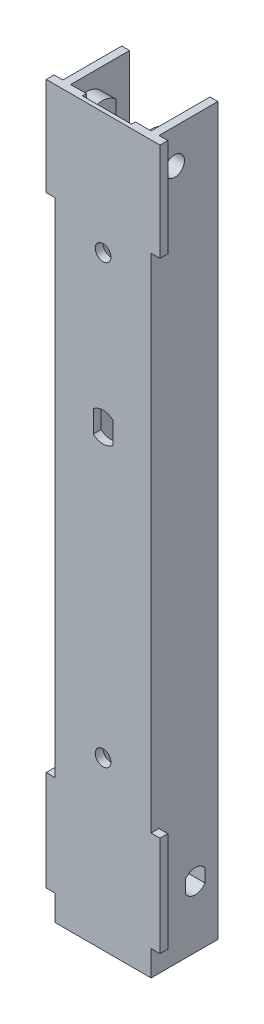
from build123d import *

# Parameters (mm, degrees)
BOSS_EXTRUDE1_DEPTH     = 370
SKETCH9_W               = 58
SKETCH9_H               = 50
SKETCH9_H_2             = 51
BOSS_EXTRUDE2_DEPTH     = 4
SKETCH14_R              = 5
BOSS_EXTRUDE3_DEPTH     = 49
CUT_EXTRUDE4_REACH      = 377.391
SKETCH15_W              = 25
SKETCH15_H              = 30
SKETCH15_W_2            = 30
SKETCH15_H_2            = 67.188472817
SKETCH16_R              = 4
CUT_EXTRUDE5_DEPTH      = 376.049663378
CUT_EXTRUDE6_DEPTH      = 376.049663378
CUT_EXTRUDE7_DEPTH      = 375.841633227
CUT_EXTRUDE7_DEPTH_BACK = 375.841633227
SKETCH18_R              = 5
CUT_EXTRUDE8_DEPTH      = 12.5


with BuildPart() as part:
    # Sketch3 → Boss-Extrude1 (new body)
    with BuildSketch(Plane(origin=(0, 0, 0), x_dir=(1, 0, 0), z_dir=(0, 1, 0))):
        Polygon((0, 0), (-49, 0), (-49, 34), (-45, 34), (-45, 4), (-4, 4), (-4, 34), (0, 34), align=None)
    extrude(amount=BOSS_EXTRUDE1_DEPTH)

    # Sketch9 → Boss-Extrude2 (add)
    with BuildSketch(Plane.XY):
        with Locations((-24.5, 345)):
            Rectangle(SKETCH9_W, SKETCH9_H)
        with Locations((-24.5, 38.5)):
            Rectangle(SKETCH9_W, SKETCH9_H_2)
    extrude(amount=-BOSS_EXTRUDE2_DEPTH)

    # Sketch14 → Boss-Extrude3 (add)
    # profile 1 of 2: a face of its own
    with BuildSketch(Plane(origin=(0, 0, 0), x_dir=(0, 0, -1), z_dir=(1, 0, 0))):
        with BuildLine():
            Line((19, 360.05579248), (19, 344.94420752))
            ThreePointArc((19, 344.94420752), (12, 342.2), (5, 344.94420752))
            Line((5, 344.94420752), (5, 360.05579248))
            ThreePointArc((5, 360.05579248), (12, 362.8), (19, 360.05579248))
        make_face()
        with Locations((12, 352.5)):
            Circle(SKETCH14_R, mode=Mode.SUBTRACT)
    # profile 2 of 2: a face of its own
    with BuildSketch(Plane(origin=(0, 0, 0), x_dir=(0, 0, -1), z_dir=(1, 0, 0))):
        with BuildLine():
            Line((29.5, 38.5), (29.5, 27.627016654))
            ThreePointArc((29.5, 27.627016654), (15.608560863, 27.436987987), (22.5, 39.5))
            Line((22.5, 39.5), (28.5, 39.5))
            Line((28.5, 39.5), (29.5, 38.5))
        make_face()
        with BuildLine():
            Line((27.5, 34.81662479), (27.5, 28.18337521))
            ThreePointArc((27.5, 28.18337521), (22.5, 25.5), (17.5, 28.18337521))
            Line((17.5, 28.18337521), (17.5, 34.81662479))
            ThreePointArc((17.5, 34.81662479), (22.5, 37.5), (27.5, 34.81662479))
        make_face(mode=Mode.SUBTRACT)
    extrude(amount=-BOSS_EXTRUDE3_DEPTH)

    # Cut-Extrude4: up to this face of the body (flat: up to its plane)
    cut_extrude4_end = Plane(part.part.faces().sort_by_distance((-24.5, 185, -4))[0])
    # Sketch15 → Cut-Extrude4 (cut, up to the picked face)
    with BuildSketch(Plane(origin=(0, 0, -34), x_dir=(-1, 0, 0), z_dir=(0, 0, -1)), mode=Mode.PRIVATE) as cut_extrude4_sk1:
        with Locations((24.5, 355)):
            Rectangle(SKETCH15_W, SKETCH15_H)
    cut_extrude4_tool1 = split(extrude(cut_extrude4_sk1.sketch, amount=-CUT_EXTRUDE4_REACH, mode=Mode.PRIVATE), bisect_by=cut_extrude4_end, keep=Keep.BOTH, mode=Mode.PRIVATE)
    # Sketch15 → Cut-Extrude4 (cut, up to the picked face)
    with BuildSketch(Plane(origin=(0, 0, -34), x_dir=(-1, 0, 0), z_dir=(0, 0, -1)), mode=Mode.PRIVATE) as cut_extrude4_sk2:
        with Locations((24.5, 33.594236409)):
            Rectangle(SKETCH15_W_2, SKETCH15_H_2)
    cut_extrude4_tool2 = split(extrude(cut_extrude4_sk2.sketch, amount=-CUT_EXTRUDE4_REACH, mode=Mode.PRIVATE), bisect_by=cut_extrude4_end, keep=Keep.BOTH, mode=Mode.PRIVATE)
    add(cut_extrude4_tool1.solids().sort_by(Axis((-24.5, 355, -34), (0, 0, 1)))[0], mode=Mode.SUBTRACT)
    add(cut_extrude4_tool2.solids().sort_by(Axis((-24.5, 33.594236, -34), (0, 0, 1)))[0], mode=Mode.SUBTRACT)

    # Sketch16 → Cut-Extrude5 (cut, through all)
    with BuildSketch(Plane(origin=(0, 0, -4), x_dir=(-1, 0, 0), z_dir=(0, 0, -1))):
        with Locations((24.5, 85)):
            Circle(SKETCH16_R)
        with Locations((24.5, 308)):
            Circle(SKETCH16_R)
    extrude(amount=-CUT_EXTRUDE5_DEPTH, mode=Mode.SUBTRACT)

    # Sketch17 → Cut-Extrude6 (cut, through all)
    with BuildSketch(Plane(origin=(0, 0, -4), x_dir=(-1, 0, 0), z_dir=(0, 0, -1))):
        with BuildLine():
            Line((19.5, 236.590169944), (19.5, 225.409830056))
            ThreePointArc((19.5, 225.409830056), (24.5, 223.5), (29.5, 225.409830056))
            Line((29.5, 225.409830056), (29.5, 236.590169944))
            ThreePointArc((29.5, 236.590169944), (24.5, 238.5), (19.5, 236.590169944))
        make_face()
    extrude(amount=-CUT_EXTRUDE6_DEPTH, mode=Mode.SUBTRACT)

    # Sketch18 → Cut-Extrude7 (cut, two sides: drawn at the far end of the back side and taken through both)
    with BuildSketch(Plane(origin=(-45, 0, 0), x_dir=(0, 0, -1), z_dir=(1, 0, 0)).offset(-CUT_EXTRUDE7_DEPTH_BACK)):
        with Locations(Location((12, 352.5, 0), (0, 0, 90))):
            Circle(SKETCH18_R)
        with BuildLine():
            Line((17.5, 34.81662479), (17.5, 28.18337521))
            ThreePointArc((17.5, 28.18337521), (22.5, 25.5), (27.5, 28.18337521))
            Line((27.5, 28.18337521), (27.5, 34.81662479))
            ThreePointArc((27.5, 34.81662479), (22.5, 37.5), (17.5, 34.81662479))
        make_face()
    extrude(amount=CUT_EXTRUDE7_DEPTH + CUT_EXTRUDE7_DEPTH_BACK, mode=Mode.SUBTRACT)

    # Sketch19 → Cut-Extrude8 (cut, symmetric)
    with BuildSketch(Plane(origin=(-24.5, 0, 0), x_dir=(0, 0, -1), z_dir=(1, 0, 0))):
        with BuildLine():
            Line((4, 370), (4, 338.5))
            ThreePointArc((4, 338.5), (2.502016162, 346.278692991), (2, 354.184387141))
            Line((2, 354.184387141), (2, 370))
            Line((2, 370), (4, 370))
        make_face()
    extrude(amount=CUT_EXTRUDE8_DEPTH, both=True, mode=Mode.SUBTRACT)


solid = part.part
